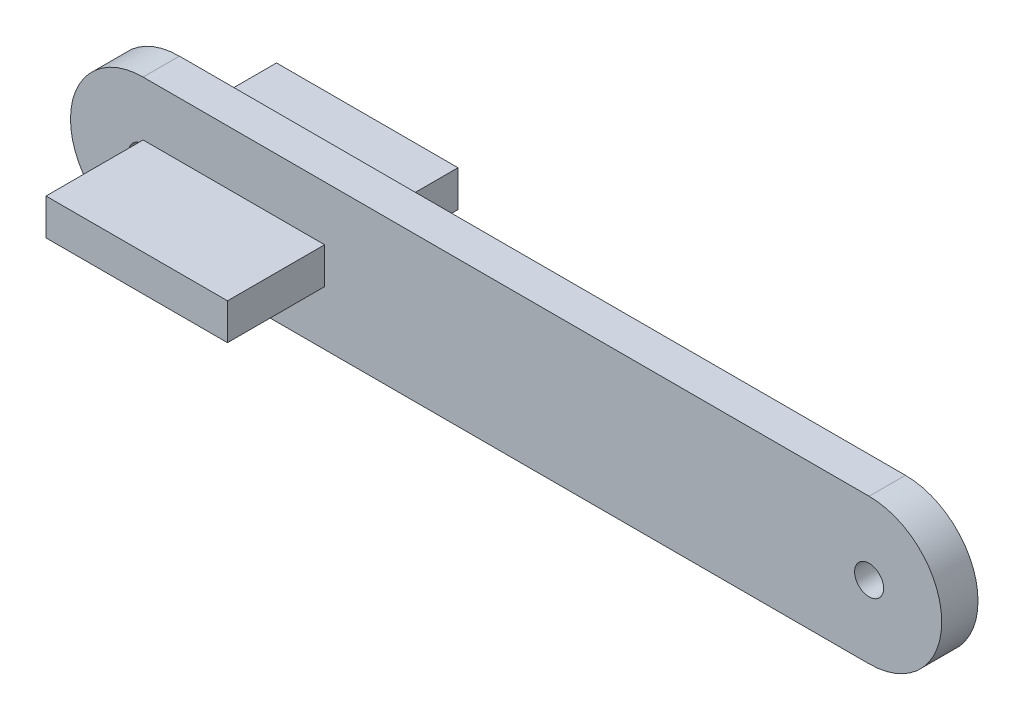
from build123d import *

# Parameters (mm, degrees)
BOSS_EXTRUDE1_DEPTH      = 2.5
BOSS_EXTRUDE1_DEPTH_BACK = 2.5
SKETCH1_R                = 2
BOSS_EXTRUDE2_START      = -50
SKETCH2_W                = 31.75
SKETCH2_H                = 5
BOSS_EXTRUDE2_DEPTH      = 25


with BuildPart() as part:
    # Sketch1 → Boss-Extrude1 (new, two sides: drawn at the far end of the back side and taken through both)
    with BuildSketch(Plane.XY.offset(-BOSS_EXTRUDE1_DEPTH_BACK)):
        with BuildLine():
            Line((-50, 10), (50, 10))
            ThreePointArc((50, 10), (60, 0), (50, -10))
            Line((50, -10), (-50, -10))
            ThreePointArc((-50, -10), (-60, 0), (-50, 10))
        make_face()
        with Locations((-50, 0)):
            Circle(SKETCH1_R, mode=Mode.SUBTRACT)
        with Locations((50, 0)):
            Circle(SKETCH1_R, mode=Mode.SUBTRACT)
    extrude(amount=BOSS_EXTRUDE1_DEPTH + BOSS_EXTRUDE1_DEPTH_BACK)

    # Sketch2 → Boss-Extrude2 (add)
    with BuildSketch(Plane(origin=(0, 0, 0), x_dir=(0, 0, -1), z_dir=(1, 0, 0)).offset(BOSS_EXTRUDE2_START)):
        Rectangle(SKETCH2_W, SKETCH2_H)
    extrude(amount=BOSS_EXTRUDE2_DEPTH)


solid = part.part
